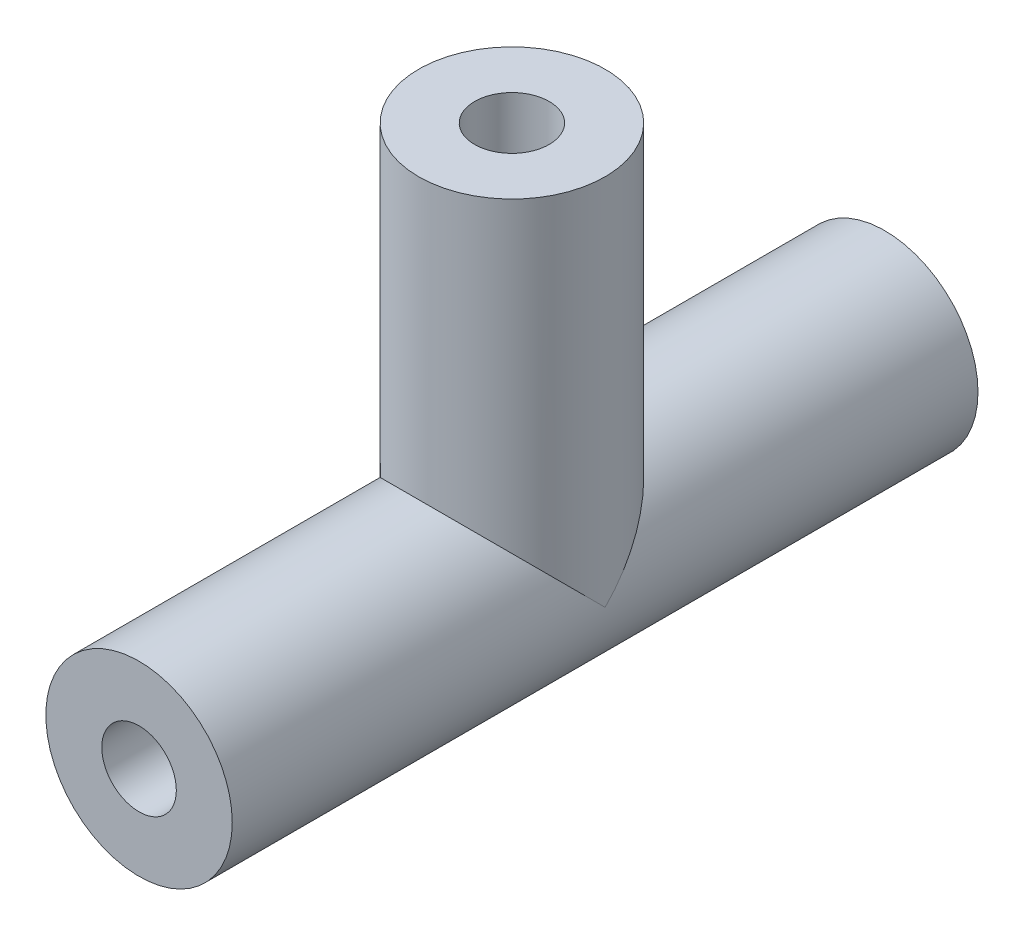
from build123d import *

# Parameters (mm, degrees)
EXTRUDE_1_DEPTH          = 15
EXTRUDE_1_DEPTH_BACK     = 5
SKETCH_1_R               = 2.5
EXTRUDE_2_REACH          = 21.685
EXTRUDE_2_END_RADIUS     = 2.5
SKETCH_3_R               = 2.5
CUT_EXTRUDE_1_REACH      = 24.5
SKETCH_6_R               = 1
CUT_EXTRUDE_3_REACH      = 21.685
CUT_EXTRUDE_3_END_RADIUS = 1
SKETCH_7_R               = 1


with BuildPart() as part:
    # 草图1 → 凸台-拉伸1 (new, two sides: drawn at the far end of the back side and taken through both)
    with BuildSketch(Plane.XY.offset(-EXTRUDE_1_DEPTH_BACK)):
        Circle(SKETCH_1_R)
    extrude(amount=EXTRUDE_1_DEPTH + EXTRUDE_1_DEPTH_BACK)

    # 凸台-拉伸2: up to this cylinder (the profile starts outside it)
    extrude_2_end = Plane(origin=(0, 0, 5), z_dir=(0, 0, 1)) * Cylinder(EXTRUDE_2_END_RADIUS, 49.37, mode=Mode.PRIVATE)
    # 草图3 → 凸台-拉伸2 (add, up to the surface)
    with BuildSketch(Plane(origin=(0, 10, 0), x_dir=(1, 0, 0), z_dir=(0, 1, 0)), mode=Mode.PRIVATE) as extrude_2_sk1:
        with Locations(Location((0, -5, 0), (0, 0, 270))):
            Circle(SKETCH_3_R)
    extrude_2_tool1 = extrude(extrude_2_sk1.sketch, amount=-EXTRUDE_2_REACH, mode=Mode.PRIVATE) - extrude_2_end
    add(extrude_2_tool1.solids().sort_by_distance((0, 10, 5))[0])

    # 草图6 → 切除-拉伸1 (cut, up to next)
    with BuildSketch(Plane(origin=(0, 0, -5), x_dir=(-1, 0, 0), z_dir=(0, 0, -1)), mode=Mode.PRIVATE) as cut_extrude_1_sk1:
        Circle(SKETCH_6_R)
    cut_extrude_1_tool1 = extrude(cut_extrude_1_sk1.sketch, amount=-CUT_EXTRUDE_1_REACH, mode=Mode.PRIVATE) & part.part
    add(cut_extrude_1_tool1.solids().sort_by_distance((0, 0, -5))[0], mode=Mode.SUBTRACT)

    # 切除-拉伸3: up to this cylinder (the profile starts outside it)
    cut_extrude_3_end = Plane(origin=(0, 0, 5), z_dir=(0, 0, -1)) * Cylinder(CUT_EXTRUDE_3_END_RADIUS, 46.37, mode=Mode.PRIVATE)
    # 草图7 → 切除-拉伸3 (cut, up to the surface)
    with BuildSketch(Plane(origin=(0, 10, 0), x_dir=(1, 0, 0), z_dir=(0, 1, 0)), mode=Mode.PRIVATE) as cut_extrude_3_sk1:
        with Locations(Location((0, -5, 0), (0, 0, 270))):
            Circle(SKETCH_7_R)
    cut_extrude_3_tool1 = extrude(cut_extrude_3_sk1.sketch, amount=-CUT_EXTRUDE_3_REACH, mode=Mode.PRIVATE) - cut_extrude_3_end
    add(cut_extrude_3_tool1.solids().sort_by_distance((0, 10, 5))[0], mode=Mode.SUBTRACT)


solid = part.part
